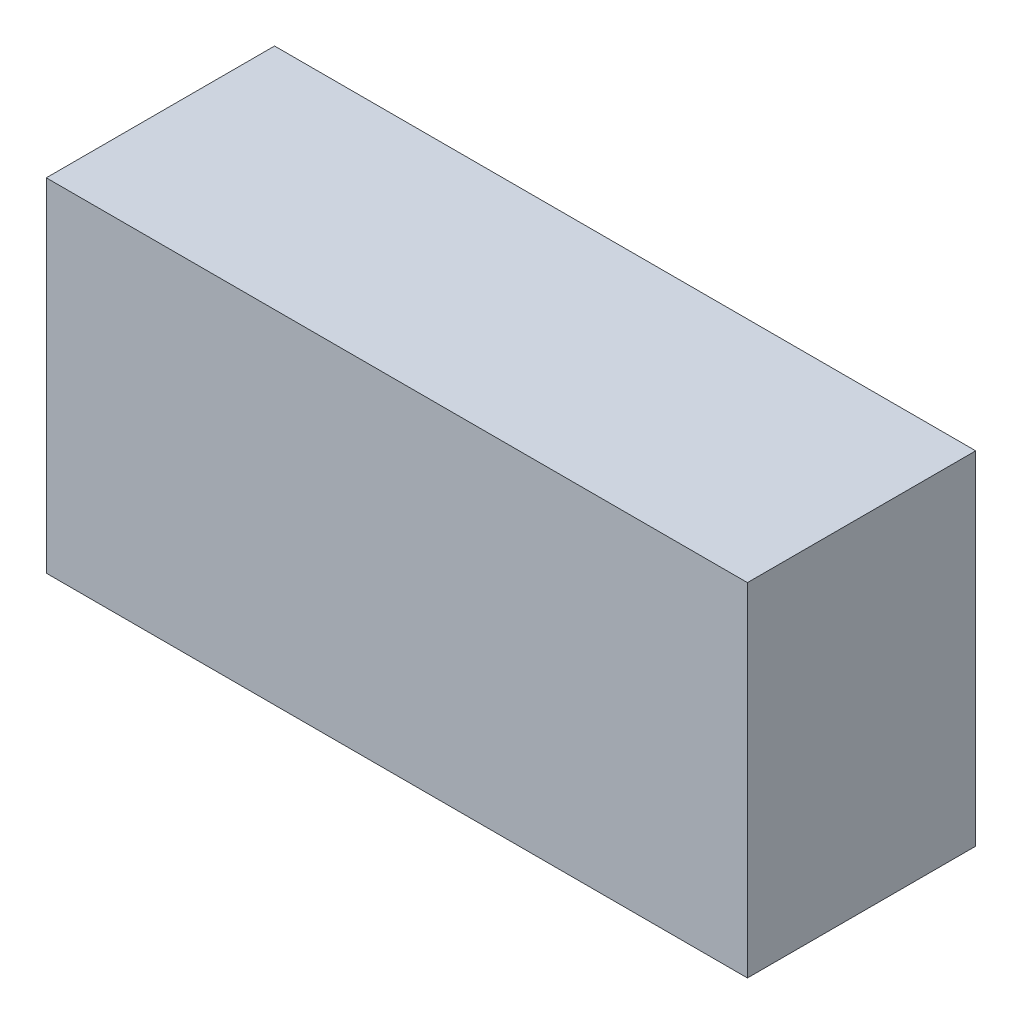
from build123d import *

# Parameters (mm, degrees)
CROQUIS1_W              = 43
CROQUIS1_H              = 21
SALIENTE_EXTRUIR1_DEPTH = 14


with BuildPart() as part:
    # Croquis1 → Saliente-Extruir1 (new body)
    with BuildSketch(Plane.XY):
        with Locations((0, 10.5)):
            Rectangle(CROQUIS1_W, CROQUIS1_H)
    extrude(amount=SALIENTE_EXTRUIR1_DEPTH)


solid = part.part
